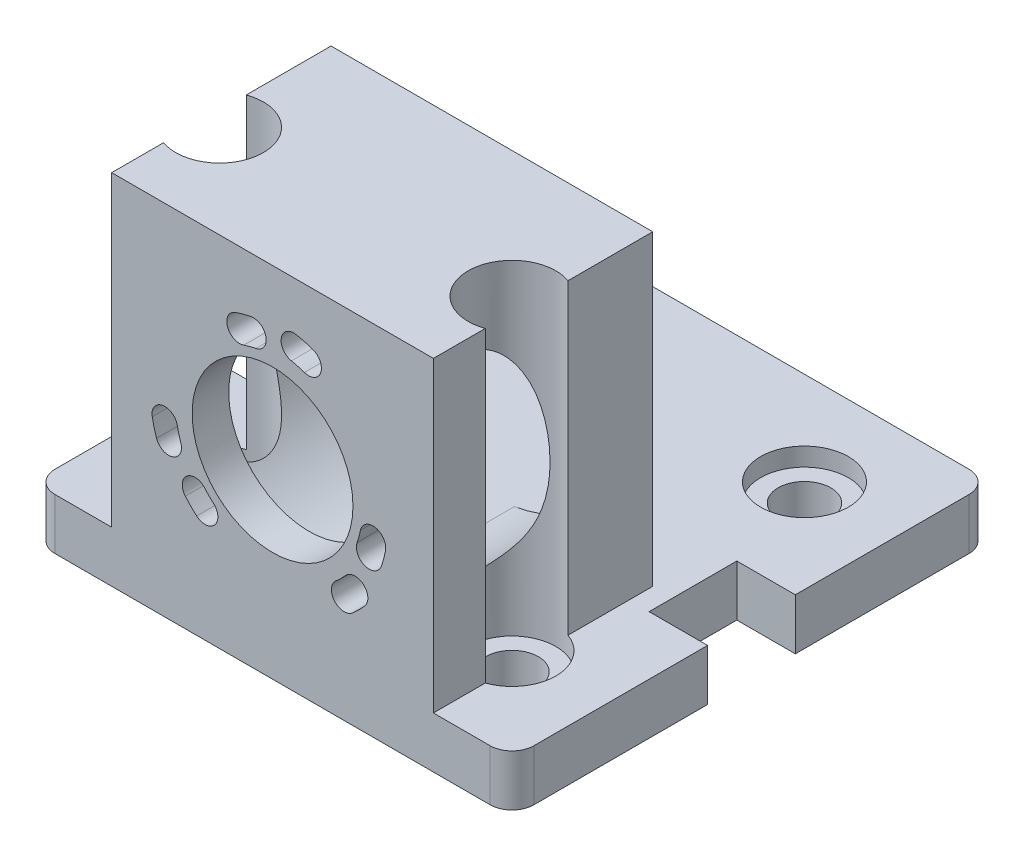
from build123d import *

# Parameters (mm, degrees)
BOSS_EXTRUDE1_DEPTH     = 7
SKETCH2_W               = 44
SKETCH2_H               = 42
SKETCH2_R               = 11
BOSS_EXTRUDE3_DEPTH     = 5
BOSS_EXTRUDE4_DEPTH     = 25
CUT_EXTRUDE6_DEPTH      = 5
CUT_EXTRUDE7_DEPTH      = 63.52299577
CUT_EXTRUDE7_DEPTH_BACK = 63.52299577
SKETCH7_W               = 8
SKETCH7_H               = 12
SKETCH7_R               = 3.6
CUT_EXTRUDE9_DEPTH      = 63.522995837
CUT_EXTRUDE9_DEPTH_BACK = 2.5
SKETCH7_4_R             = 6
SKETCH7_4_R_2           = 3.6
SKETCH7_4_W             = 8
SKETCH7_4_H             = 12


with BuildPart() as part:
    # Sketch1 → Boss-Extrude1 (new body)
    with BuildSketch(Plane(origin=(0, 0, 0), x_dir=(1, 0, 0), z_dir=(0, 1, 0))):
        with BuildLine():
            Line((-29.75, 32.75), (29.75, 32.75))
            ThreePointArc((29.75, 32.75), (31.871320344, 31.871320344), (32.75, 29.75))
            Line((32.75, 29.75), (32.75, -29.75))
            ThreePointArc((32.75, -29.75), (31.871320344, -31.871320344), (29.75, -32.75))
            Line((29.75, -32.75), (-29.75, -32.75))
            ThreePointArc((-29.75, -32.75), (-31.871320344, -31.871320344), (-32.75, -29.75))
            Line((-32.75, -29.75), (-32.75, 29.75))
            ThreePointArc((-32.75, 29.75), (-31.871320344, 31.871320344), (-29.75, 32.75))
        make_face()
    extrude(amount=BOSS_EXTRUDE1_DEPTH)

    # Sketch2 → Boss-Extrude3 (add)
    with BuildSketch(Plane.XY.offset(32.75)):
        with Locations((0, 28)):
            Rectangle(SKETCH2_W, SKETCH2_H)
        with Locations((0, 26)):
            Circle(SKETCH2_R, mode=Mode.SUBTRACT)
    extrude(amount=-BOSS_EXTRUDE3_DEPTH)

    # Sketch3 → Boss-Extrude4 (add)
    with BuildSketch(Plane(origin=(0, 0, 27.75), x_dir=(-1, 0, 0), z_dir=(0, 0, -1))):
        with BuildLine():
            ThreePointArc((-3.092329219, 7), (0, 45.25), (3.092329219, 7))
            Line((3.092329219, 7), (22, 7))
            Line((22, 7), (22, 49))
            Line((22, 49), (-22, 49))
            Line((-22, 49), (-22, 7))
            Line((-22, 7), (-3.092329219, 7))
        make_face()
    extrude(amount=BOSS_EXTRUDE4_DEPTH)

    # Sketch6 → Cut-Extrude6 (cut)
    with BuildSketch(Plane.XY.offset(32.75)):
        with BuildLine():
            ThreePointArc((12.015935701, 23.616769161), (11.820419706, 22.784385288), (11.567315814, 21.967667567))
            ThreePointArc((11.567315814, 21.967667567), (12.643742012, 19.739146389), (14.87226319, 20.815572586))
            ThreePointArc((14.87226319, 20.815572586), (15.197682479, 21.865638228), (15.449060187, 22.935846064))
            ThreePointArc((15.449060187, 22.935846064), (14.072959492, 24.992869856), (12.015935701, 23.616769161))
        make_face()
        with BuildLine():
            ThreePointArc((9.966693425, 17.269162573), (9.333382629, 16.595189066), (8.654600531, 15.967034853))
            ThreePointArc((8.654600531, 15.967034853), (8.472552374, 13.498865801), (10.940721426, 13.316817644))
            ThreePointArc((10.940721426, 13.316817644), (11.798804456, 14.110899386), (12.599404896, 14.96290363))
            ThreePointArc((12.599404896, 14.96290363), (12.436178632, 17.432388837), (9.966693425, 17.269162573))
        make_face()
        with BuildLine():
            ThreePointArc((-9.275760231, 17.998576867), (-11.743929282, 18.180625024), (-11.925977439, 15.712455972))
            ThreePointArc((-11.925977439, 15.712455972), (-11.179303563, 14.905601781), (-10.378165243, 14.152798382))
            ThreePointArc((-10.378165243, 14.152798382), (-7.908680036, 14.316024645), (-8.0719063, 16.785509852))
            ThreePointArc((-8.0719063, 16.785509852), (-8.695013882, 17.371023607), (-9.275760231, 17.998576867))
        make_face()
        with BuildLine():
            ThreePointArc((-13.016102958, 23.521378654), (-15.06257598, 24.913121509), (-16.454318834, 22.866648487))
            ThreePointArc((-16.454318834, 22.866648487), (-16.195665388, 21.726485914), (-15.858108288, 20.607143472))
            ThreePointArc((-15.858108288, 20.607143472), (-13.637858233, 19.51375896), (-12.54447372, 21.734009016))
            ThreePointArc((-12.54447372, 21.734009016), (-12.811496501, 22.619459007), (-13.016102958, 23.521378654))
        make_face()
        with BuildLine():
            ThreePointArc((-2.291555584, 38.033755565), (-0.899812729, 40.080228587), (-2.946285751, 41.471971441))
            ThreePointArc((-2.946285751, 41.471971441), (-4.018378916, 41.228759992), (-5.070894944, 40.911355554))
            ThreePointArc((-5.070894944, 40.911355554), (-6.164279456, 38.691105499), (-3.944029401, 37.597720987))
            ThreePointArc((-3.944029401, 37.597720987), (-3.125405824, 37.844591105), (-2.291555584, 38.033755565))
        make_face()
        with BuildLine():
            ThreePointArc((4.361502427, 38.511586493), (6.590023605, 39.588012691), (5.513597408, 41.816533869))
            ThreePointArc((5.513597408, 41.816533869), (4.396860932, 42.1626147), (3.258703392, 42.429952897))
            ThreePointArc((3.258703392, 42.429952897), (1.201679601, 41.053852203), (2.577780295, 38.996828411))
            ThreePointArc((2.577780295, 38.996828411), (3.478113872, 38.785351927), (4.361502427, 38.511586493))
        make_face()
    extrude(amount=-CUT_EXTRUDE6_DEPTH, mode=Mode.SUBTRACT)

    # Sketch7 → Cut-Extrude7 (cut, two sides: drawn at the far end of the back side and taken through both)
    with BuildSketch(Plane(origin=(0, 7, 0), x_dir=(1, 0, 0), z_dir=(0, 1, 0)).offset(-CUT_EXTRUDE7_DEPTH_BACK)):
        with Locations((-28.75, 0)):
            Rectangle(SKETCH7_W, SKETCH7_H)
        with Locations((28.75, 0)):
            Rectangle(SKETCH7_W, SKETCH7_H)
        with Locations(Location((-20, 20, 0), (0, 0, 270))):
            Circle(SKETCH7_R)
        with Locations(Location((20, 20, 0), (0, 0, 270))):
            Circle(SKETCH7_R)
        with Locations(Location((20, -20, 0), (0, 0, 270))):
            Circle(SKETCH7_R)
        with Locations(Location((-20, -20, 0), (0, 0, 270))):
            Circle(SKETCH7_R)
    extrude(amount=CUT_EXTRUDE7_DEPTH + CUT_EXTRUDE7_DEPTH_BACK, mode=Mode.SUBTRACT)

    # Sketch7<4> → Cut-Extrude9 (cut, two sides: drawn at the far end of the back side and taken through both)
    # profile 1 of 6: a face of its own
    with BuildSketch(Plane(origin=(0, 7, 0), x_dir=(1, 0, 0), z_dir=(0, 1, 0)).offset(-CUT_EXTRUDE9_DEPTH_BACK)):
        with Locations(Location((-20, 20, 0), (0, 0, 90))):
            Circle(SKETCH7_4_R)
        with Locations(Location((-20, 20, 0), (0, 0, 270))):
            Circle(SKETCH7_4_R_2, mode=Mode.SUBTRACT)
    # profile 2 of 6: a face of its own
    with BuildSketch(Plane(origin=(0, 7, 0), x_dir=(1, 0, 0), z_dir=(0, 1, 0)).offset(-CUT_EXTRUDE9_DEPTH_BACK)):
        with Locations(Location((20, 20, 0), (0, 0, 90))):
            Circle(SKETCH7_4_R)
        with Locations(Location((20, 20, 0), (0, 0, 270))):
            Circle(SKETCH7_4_R_2, mode=Mode.SUBTRACT)
    # profile 3 of 6: a face of its own
    with BuildSketch(Plane(origin=(0, 7, 0), x_dir=(1, 0, 0), z_dir=(0, 1, 0)).offset(-CUT_EXTRUDE9_DEPTH_BACK)):
        with Locations(Location((20, -20, 0), (0, 0, 70.528779366))):
            Circle(SKETCH7_4_R)
        with Locations(Location((20, -20, 0), (0, 0, 270))):
            Circle(SKETCH7_4_R_2, mode=Mode.SUBTRACT)
    # profile 4 of 6: a face of its own
    with BuildSketch(Plane(origin=(0, 7, 0), x_dir=(1, 0, 0), z_dir=(0, 1, 0)).offset(-CUT_EXTRUDE9_DEPTH_BACK)):
        with Locations(Location((-20, -20, 0), (0, 0, 109.471220634))):
            Circle(SKETCH7_4_R)
        with Locations(Location((-20, -20, 0), (0, 0, 270))):
            Circle(SKETCH7_4_R_2, mode=Mode.SUBTRACT)
    # profile 5 of 6: a face of its own
    with BuildSketch(Plane(origin=(0, 7, 0), x_dir=(1, 0, 0), z_dir=(0, 1, 0)).offset(-CUT_EXTRUDE9_DEPTH_BACK)):
        with Locations((-28.75, 0)):
            Rectangle(SKETCH7_4_W, SKETCH7_4_H)
    # profile 6 of 6: a face of its own
    with BuildSketch(Plane(origin=(0, 7, 0), x_dir=(1, 0, 0), z_dir=(0, 1, 0)).offset(-CUT_EXTRUDE9_DEPTH_BACK)):
        with Locations((28.75, 0)):
            Rectangle(SKETCH7_4_W, SKETCH7_4_H)
    extrude(amount=CUT_EXTRUDE9_DEPTH + CUT_EXTRUDE9_DEPTH_BACK, mode=Mode.SUBTRACT)


solid = part.part
